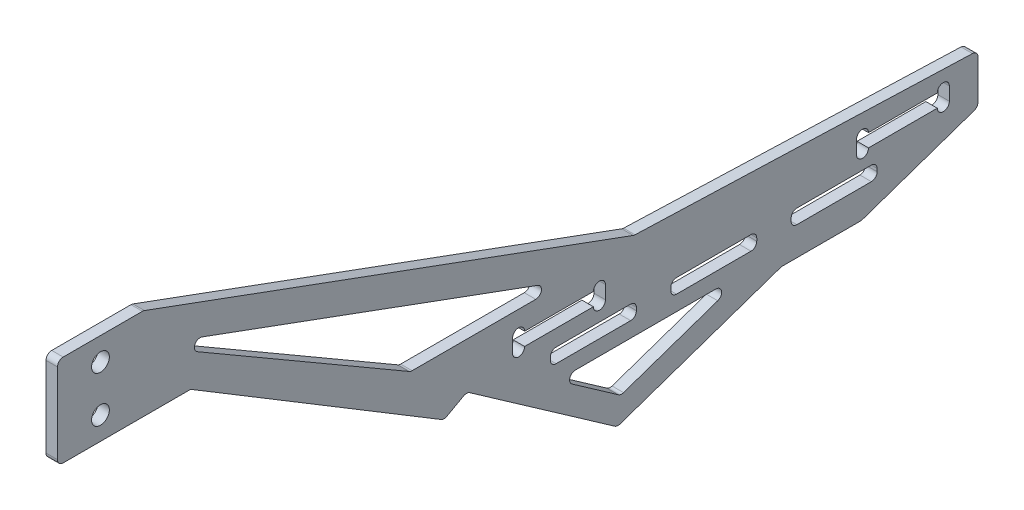
from build123d import *

# Parameters (mm, degrees)
SKETCH_1_W      = 15
SKETCH_1_H      = 2.5
SKETCH_1_R      = 1.55
EXTRUDE_1_DEPTH = 2
FILLET_1_R      = 1


with BuildPart() as part:
    # 草图1 → 凸台-拉伸1 (new body)
    with BuildSketch(Plane(origin=(0, 0, 0), x_dir=(0, 0, -1), z_dir=(1, 0, 0))):
        Polygon((7.5, 12), (-7.5, 12), (-7.5, -4), (15.739132695, -4), (59.924651317, -30.703841765), (61.202132807, -30), (63.924651317, -28.5), (90.154353452, -46.86623516), (118.807980924, -37), (132.770523856, -37), (153.1, -30), (153.1, -21.5), (93.1, -19.40475383), align=None)
        with Locations((128, -30.75)):
            Rectangle(SKETCH_1_W, SKETCH_1_H, mode=Mode.SUBTRACT)
        with Locations((107, -30.75)):
            Rectangle(SKETCH_1_W, SKETCH_1_H, mode=Mode.SUBTRACT)
        with Locations((86, -30.75)):
            Rectangle(SKETCH_1_W, SKETCH_1_H, mode=Mode.SUBTRACT)
        with BuildLine():
            Line((86, -26.65), (74, -26.65))
            ThreePointArc((74, -26.65), (72.95, -27.7), (71.9, -26.65))
            Line((71.9, -26.65), (71.9, -24.35))
            ThreePointArc((71.9, -24.35), (72.95, -23.3), (74, -24.35))
            Line((74, -24.35), (86, -24.35))
            ThreePointArc((86, -24.35), (87.05, -23.3), (88.1, -24.35))
            Line((88.1, -24.35), (88.1, -26.65))
            ThreePointArc((88.1, -26.65), (87.05, -27.7), (86, -26.65))
        make_face(mode=Mode.SUBTRACT)
        with BuildLine():
            Line((146, -26.65), (134, -26.65))
            ThreePointArc((134, -26.65), (132.95, -27.7), (131.9, -26.65))
            Line((131.9, -26.65), (131.9, -24.35))
            ThreePointArc((131.9, -24.35), (132.95, -23.3), (134, -24.35))
            Line((134, -24.35), (146, -24.35))
            ThreePointArc((146, -24.35), (147.05, -23.3), (148.1, -24.35))
            Line((148.1, -24.35), (148.1, -26.65))
            ThreePointArc((148.1, -26.65), (147.05, -27.7), (146, -26.65))
        make_face(mode=Mode.SUBTRACT)
        Polygon((54.105215944, -20.5), (7, 6.857560085), (81.568555955, -20.5), align=None, mode=Mode.SUBTRACT)
        Circle(SKETCH_1_R, mode=Mode.SUBTRACT)
        with Locations((0, 8)):
            Circle(SKETCH_1_R, mode=Mode.SUBTRACT)
        Polygon((79.681548741, -34.65), (113.34666254, -34.65), (90.779143943, -42.420619816), align=None, mode=Mode.SUBTRACT)
    extrude(amount=EXTRUDE_1_DEPTH)

    # 圆角1
    fillet_1_edges = [part.edges().sort_by_distance(p)[0] for p in [
        (1, -32, -135.5),
        (1, -29.5, -135.5),
        (1, -29.5, -120.5),
        (1, -32, -120.5),
        (1, -32, -114.5),
        (1, -29.5, -114.5),
        (1, -29.5, -99.5),
        (1, -32, -99.5),
        (1, -32, -93.5),
        (1, -29.5, -93.5),
        (1, -29.5, -78.5),
        (1, -32, -78.5),
        (1, -34.65, -113.34666254),
        (1, -34.65, -79.681548741),
        (1, -42.420619816, -90.779143943),
        (1, 6.857560085, -7),
        (1, -20.5, -54.105215944),
        (1, -20.5, -81.568555955),
        (1, -46.86623516, -90.154353452),
        (1, -28.5, -63.924651317),
        (1, -30.703841765, -59.924651317),
        (1, -4, -15.739132695),
        (1, -4, 7.5),
        (1, 12, 7.5),
        (1, 12, -7.5),
        (1, -19.40475383, -93.1),
        (1, -21.5, -153.1),
        (1, -30, -153.1),
        (1, -37, -132.770523856),
        (1, -37, -118.807980924),
    ]]
    fillet(fillet_1_edges, radius=FILLET_1_R)


solid = part.part
